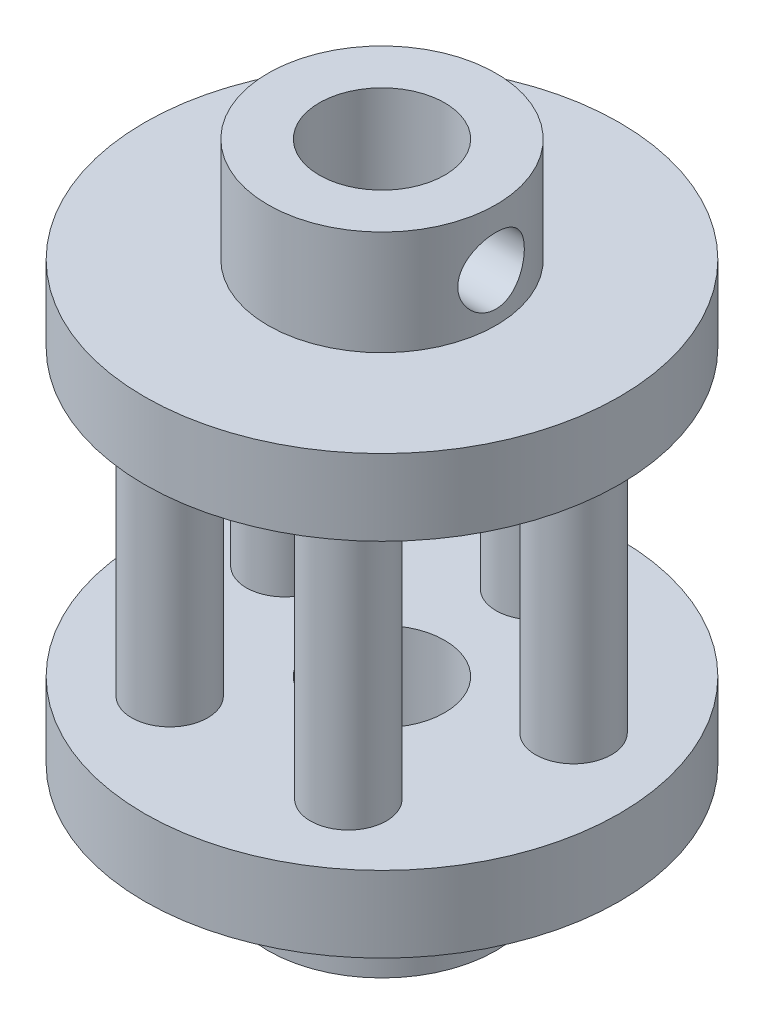
from build123d import *
from build123d.topology import SkipClean

# Parameters (mm, degrees)
SKETCH1_R               = 12.5
SKETCH1_R_2             = 3.3
BOSS_EXTRUDE1_DEPTH     = 4
BOSS_EXTRUDE7_START     = 5.5
SKETCH8_R               = 6
SKETCH8_R_2             = 3.3
BOSS_EXTRUDE7_DEPTH     = 5.5
SKETCH9_R               = 2
BOSS_EXTRUDE8_DEPTH     = 15
SKETCH10_R              = 12.5
SKETCH10_R_2            = 3.3
BOSS_EXTRUDE9_DEPTH     = 4
SKETCH11_R              = 6
SKETCH11_R_2            = 3.3
BOSS_EXTRUDE10_DEPTH    = 5.5
CUT_EXTRUDE3_REACH      = 38.204
CUT_EXTRUDE3_END_RADIUS = 3.3
SKETCH12_R              = 1.75
CUT_EXTRUDE4_REACH      = 38.204
CUT_EXTRUDE4_END_RADIUS = 3.3
SKETCH13_R              = 1.75


with BuildPart() as part:
    # Sketch1 → Boss-Extrude1 (new body)
    with BuildSketch(Plane(origin=(0, 0, 0), x_dir=(1, 0, 0), z_dir=(0, 1, 0))):
        with Locations(Location((0, 0, 0), (0, 0, 270))):
            Circle(SKETCH1_R)
        with Locations(Location((0, 0, 0), (0, 0, 270))):
            Circle(SKETCH1_R_2, mode=Mode.SUBTRACT)
    extrude(amount=BOSS_EXTRUDE1_DEPTH)

    # Sketch8 → Boss-Extrude7 (add)
    with SkipClean():  # the faces are left unmerged after this step: merging them gives an invalid solid
        with BuildSketch(Plane.XZ.offset(BOSS_EXTRUDE7_START)):
            with Locations(Location((0, 0, 0), (0, 0, 90))):
                Circle(SKETCH8_R)
            with Locations(Location((0, 0, 0), (0, 0, 270))):
                Circle(SKETCH8_R_2, mode=Mode.SUBTRACT)
        extrude(amount=-BOSS_EXTRUDE7_DEPTH)

    # Sketch9 → Boss-Extrude8 (add)
    with SkipClean():  # the faces are left unmerged after this step: merging them gives an invalid solid
        with BuildSketch(Plane(origin=(0, 4, 0), x_dir=(1, 0, 0), z_dir=(0, 1, 0))):
            with Locations(Location((0, 8, 0), (0, 0, 270))):
                Circle(SKETCH9_R)
            with Locations(Location((7.60845213, 2.472135955, 0), (0, 0, 270))):
                Circle(SKETCH9_R)
            with Locations(Location((4.702282018, -6.472135955, 0), (0, 0, 270))):
                Circle(SKETCH9_R)
            with Locations(Location((-4.702282018, -6.472135955, 0), (0, 0, 270))):
                Circle(SKETCH9_R)
            with Locations(Location((-7.60845213, 2.472135955, 0), (0, 0, 270))):
                Circle(SKETCH9_R)
        extrude(amount=BOSS_EXTRUDE8_DEPTH)

    # Sketch10 → Boss-Extrude9 (add)
    with SkipClean():  # the faces are left unmerged after this step: merging them gives an invalid solid
        with BuildSketch(Plane(origin=(0, 19, 0), x_dir=(1, 0, 0), z_dir=(0, 1, 0))):
            with Locations(Location((0, 0, 0), (0, 0, 270))):
                Circle(SKETCH10_R)
            with Locations(Location((0, 0, 0), (0, 0, 90))):
                Circle(SKETCH10_R_2, mode=Mode.SUBTRACT)
        extrude(amount=BOSS_EXTRUDE9_DEPTH)

    # Sketch11 → Boss-Extrude10 (add)
    with SkipClean():  # the faces are left unmerged after this step: merging them gives an invalid solid
        with BuildSketch(Plane(origin=(0, 23, 0), x_dir=(1, 0, 0), z_dir=(0, 1, 0))):
            with Locations(Location((0, 0, 0), (0, 0, 270))):
                Circle(SKETCH11_R)
            with Locations(Location((0, 0, 0), (0, 0, 90))):
                Circle(SKETCH11_R_2, mode=Mode.SUBTRACT)
        extrude(amount=BOSS_EXTRUDE10_DEPTH)

    # Cut-Extrude3: up to this cylinder (the profile starts outside it)
    with SkipClean():  # the faces are left unmerged after this step: merging them gives an invalid solid
        cut_extrude3_end = Plane(origin=(0, 25.5, 0), z_dir=(0, -1, 0)) * Cylinder(CUT_EXTRUDE3_END_RADIUS, 84.008, mode=Mode.PRIVATE)
        # Sketch12 → Cut-Extrude3 (cut, up to the surface)
        with BuildSketch(Plane(origin=(6, 0, 0), x_dir=(0, 0, -1), z_dir=(1, 0, 0)), mode=Mode.PRIVATE) as cut_extrude3_sk1:
            with Locations((0, 25.5)):
                Circle(SKETCH12_R)
        cut_extrude3_tool1 = extrude(cut_extrude3_sk1.sketch, amount=-CUT_EXTRUDE3_REACH, mode=Mode.PRIVATE) - cut_extrude3_end
        add(cut_extrude3_tool1.solids().sort_by_distance((6, 25.5, 0))[0], mode=Mode.SUBTRACT)

    # Cut-Extrude4: up to this cylinder (the profile starts outside it)
    with SkipClean():  # the faces are left unmerged after this step: merging them gives an invalid solid
        cut_extrude4_end = Plane(origin=(0, -2.5, 0), z_dir=(0, -1, 0)) * Cylinder(CUT_EXTRUDE4_END_RADIUS, 84.008, mode=Mode.PRIVATE)
        # Sketch13 → Cut-Extrude4 (cut, up to the surface)
        with BuildSketch(Plane(origin=(6, 0, 0), x_dir=(0, 0, -1), z_dir=(1, 0, 0)), mode=Mode.PRIVATE) as cut_extrude4_sk1:
            with Locations((0, -2.5)):
                Circle(SKETCH13_R)
        cut_extrude4_tool1 = extrude(cut_extrude4_sk1.sketch, amount=-CUT_EXTRUDE4_REACH, mode=Mode.PRIVATE) - cut_extrude4_end
        add(cut_extrude4_tool1.solids().sort_by_distance((6, -2.5, 0))[0], mode=Mode.SUBTRACT)


solid = part.part
